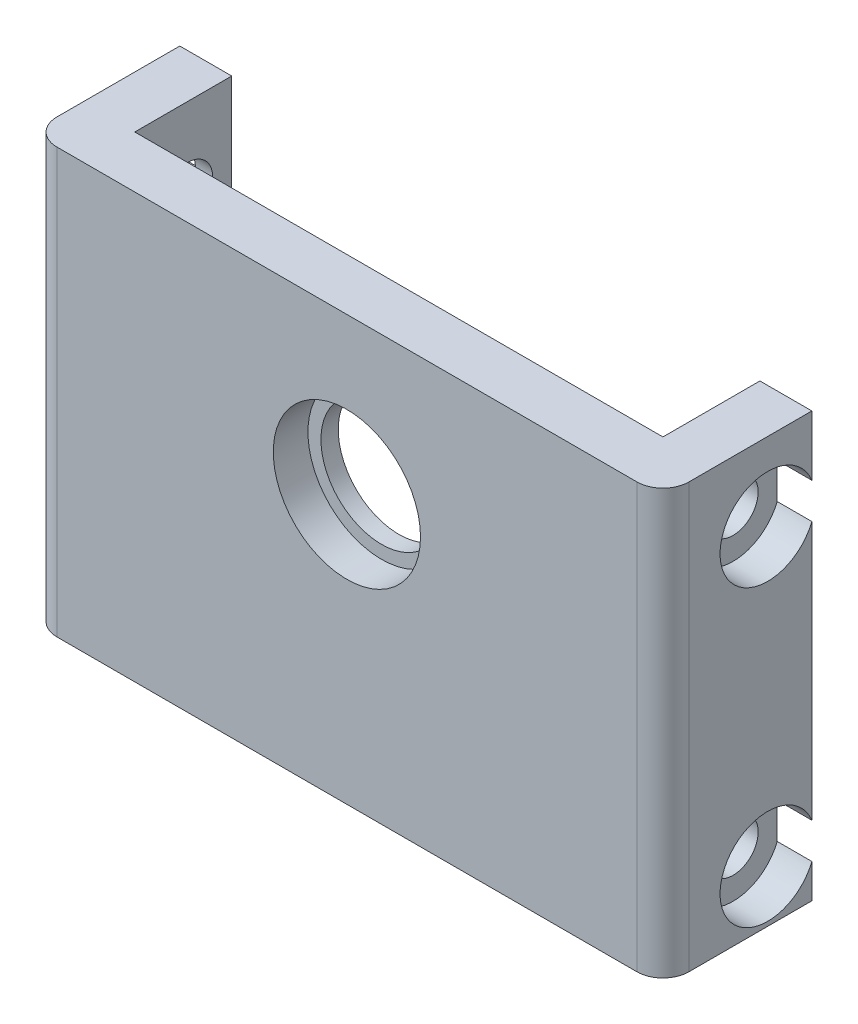
from build123d import *

# Parameters (mm, degrees)
RESSALTO_EXTRUS_O1_START         = 0.25
ESBO_O2_W                        = 30.5
ESBO_O2_H                        = 24.5
RESSALTO_EXTRUS_O1_DEPTH         = 3
ESBO_O3_W                        = 8.6
ESBO_O3_H                        = 24.5
RESSALTO_EXTRUS_O2_DEPTH         = 3
ESBO_O5_R                        = 4.25
CORTE_EXTRUS_O1_DEPTH            = 2
ESBO_O12_R                       = 3.5
CORTE_EXTRUS_O3_DEPTH            = 41.141904539
CBORE_FOR_M2_5_SHCS1_D           = 2.9
CBORE_FOR_M2_5_SHCS1_DEPTH       = 3
CBORE_FOR_M2_5_SHCS1_CBORE_D     = 5.5
CBORE_FOR_M2_5_SHCS1_CBORE_DEPTH = 2
FILETE1_R                        = 1.5


with BuildPart() as part:
    # Esboço2 → Ressalto-extrusão1 (new body)
    with BuildSketch(Plane.XY.offset(RESSALTO_EXTRUS_O1_START)):
        with Locations((15, -9.25)):
            Rectangle(ESBO_O2_W, ESBO_O2_H)
    extrude(amount=RESSALTO_EXTRUS_O1_DEPTH)

    # Esboço3 → Ressalto-extrusão2 (add)
    with BuildSketch(Plane.ZY.offset(0.25)):
        with Locations((-1.05, -9.25)):
            Rectangle(ESBO_O3_W, ESBO_O3_H)
    ressalto_extrus_o2 = extrude(amount=RESSALTO_EXTRUS_O2_DEPTH)

    # Espelhar1: Ressalto-extrusão2 across plane
    add(ressalto_extrus_o2.mirror(Plane.ZY.offset(-15)))

    # Esboço5 → Corte-extrusão1 (cut)
    with BuildSketch(Plane.XY.offset(3.25)):
        with Locations((15, -6)):
            Circle(ESBO_O5_R)
    extrude(amount=-CORTE_EXTRUS_O1_DEPTH, mode=Mode.SUBTRACT)

    # Esboço12 → Corte-extrusão3 (cut, through all)
    with BuildSketch(Plane.XY.offset(1.25)):
        with Locations((15, -6)):
            Circle(ESBO_O12_R)
    extrude(amount=-CORTE_EXTRUS_O3_DEPTH, mode=Mode.SUBTRACT)

    # CBORE for M2.5 SHCS1
    with Locations(Plane.ZY.offset(3.25)):
        with Locations((-2.8, -1.5), (-2.8, -18.5)):
            cbore_for_m2_5_shcs1 = CounterBoreHole(CBORE_FOR_M2_5_SHCS1_D / 2, CBORE_FOR_M2_5_SHCS1_CBORE_D / 2, CBORE_FOR_M2_5_SHCS1_CBORE_DEPTH, depth=CBORE_FOR_M2_5_SHCS1_DEPTH)

    # Mirror1: CBORE for M2.5 SHCS1 across plane
    add(cbore_for_m2_5_shcs1.mirror(Plane.ZY.offset(-15)), mode=Mode.SUBTRACT)

    # Filete1
    filete1_edges = [part.edges().sort_by_distance(p)[0] for p in [
        (-3.25, -9.25, 3.25),
        (33.25, -9.25, 3.25),
    ]]
    fillet(filete1_edges, radius=FILETE1_R)


solid = part.part
